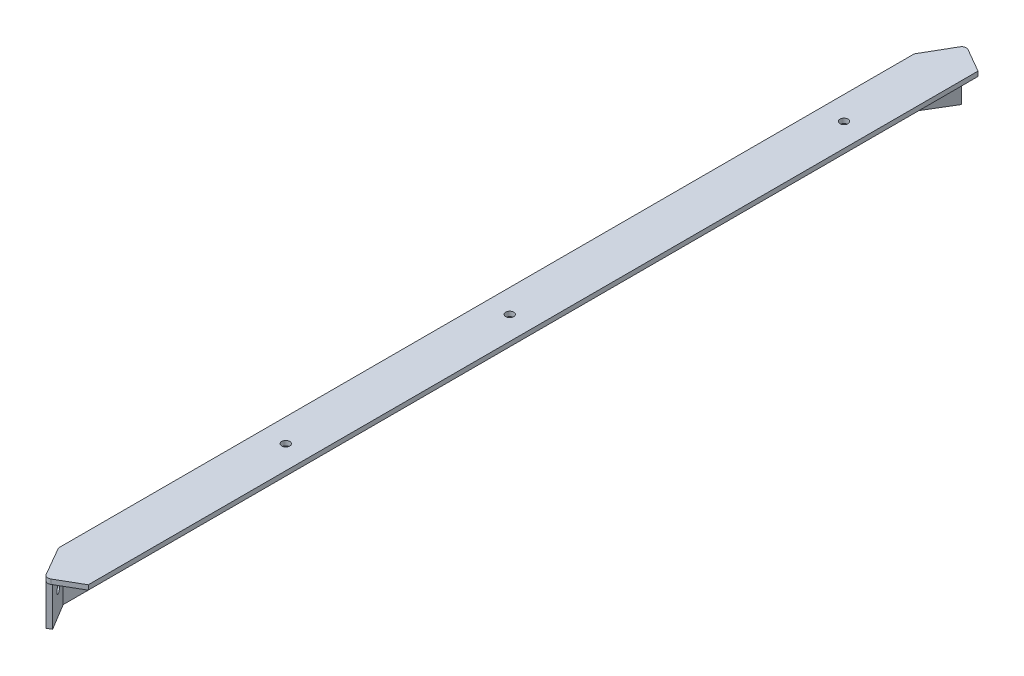
from build123d import *

# Parameters (mm, degrees)
BOSS_EXTRUDE1_DEPTH = 640
BOSS_EXTRUDE2_DEPTH = 63
BOSS_EXTRUDE4_DEPTH = 7
SKETCH10_R          = 6
CUT_EXTRUDE3_DEPTH  = 7
FILLET5_R           = 5
SKETCH22_R          = 6
CUT_EXTRUDE4_DEPTH  = 10


with BuildPart() as part:
    # Sketch1 → Boss-Extrude1 (new body)
    with BuildSketch(Plane.XY):
        Polygon((0, 0), (0, 70), (70, 70), (70, 63), (7, 63), (7, 0), align=None)
    extrude(amount=BOSS_EXTRUDE1_DEPTH)

    # Sketch2 → Boss-Extrude2 (add)
    with BuildSketch(Plane(origin=(0, 0, 0), x_dir=(1, 0, 0), z_dir=(0, 1, 0))):
        Polygon((0, -640), (25, -683.301270189), (31.062177826, -679.801270189), (7, -640), align=None)
    extrude(amount=BOSS_EXTRUDE2_DEPTH)

    # Sketch9 → Boss-Extrude4 (add)
    with BuildSketch(Plane(origin=(0, 63, 0), x_dir=(1, 0, 0), z_dir=(0, 1, 0))):
        with BuildLine():
            Line((0, -640), (25, -683.301270189))
            ThreePointArc((25, -683.301270189), (29.250444511, -686.562750973), (34.562177826, -685.863448016))
            Line((34.562177826, -685.863448016), (70, -665.403411844))
            Line((70, -665.403411844), (70, -640))
            Line((70, -640), (0, -640))
        make_face()
    extrude(amount=BOSS_EXTRUDE4_DEPTH)

    # Sketch10 → Cut-Extrude3 (cut)
    with BuildSketch(Plane(origin=(-278.227615862, 0, 168.20474164), x_dir=(-0.5173609804017633, 0, -0.8557672674026079), z_dir=(0.8557672674026079, 0, -0.5173609804017633))):
        with Locations((-572.82203414, 35)):
            Circle(SKETCH10_R)
    extrude(amount=-CUT_EXTRUDE3_DEPTH, mode=Mode.SUBTRACT)

    # Fillet5
    fillet5_edges = [part.edges().sort_by_distance(p)[0] for p in [
        (7, 63, 320),
        (19.031088913, 63, 659.900635095),
    ]]
    fillet(fillet5_edges, radius=FILLET5_R)

    # Mirror6: part across plane


with BuildPart() as part_1:
    add(part.part)
    add(part.part.mirror(Plane.XY))

    # Sketch22 → Cut-Extrude4 (cut)
    with BuildSketch(Plane(origin=(0, 70, 0), x_dir=(1, 0, 0), z_dir=(0, 1, 0))):
        with Locations(Location((35, 0, 0), (0, 0, 270))):
            Circle(SKETCH22_R)
        with Locations(Location((35, 500, 0), (0, 0, 270))):
            Circle(SKETCH22_R)
        with Locations(Location((35, -335, 0), (0, 0, 270))):
            Circle(SKETCH22_R)
    extrude(amount=-CUT_EXTRUDE4_DEPTH, mode=Mode.SUBTRACT)


solid = part_1.part
